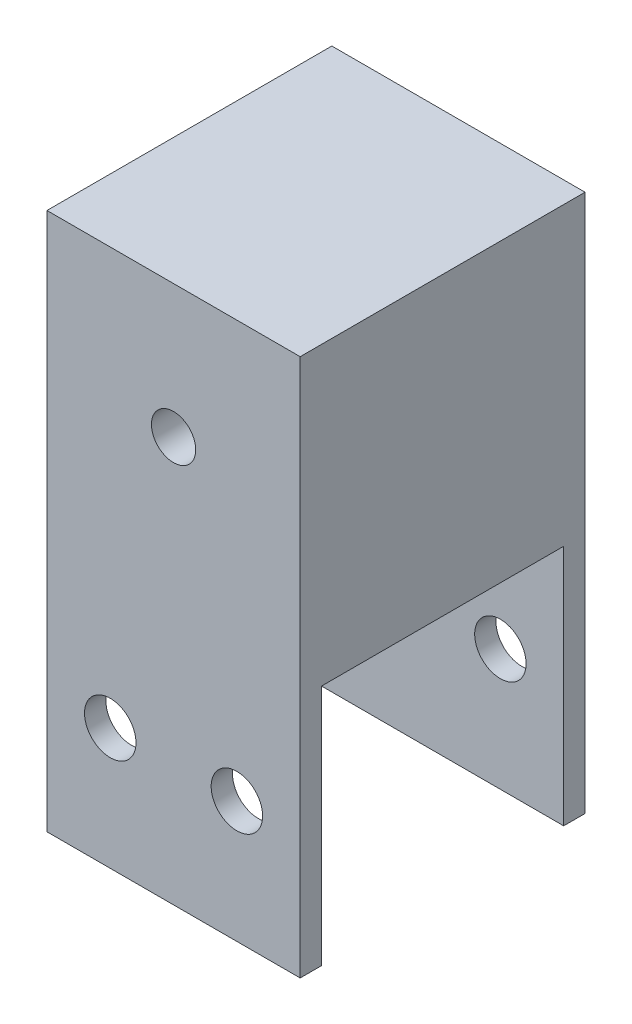
from build123d import *

# Parameters (mm, degrees)
ESQUISSE1_W                  = 40
ESQUISSE1_H                  = 85
BOSS_EXTRU_1_DEPTH           = 45
ESQUISSE2_W                  = 38.25
ESQUISSE2_H                  = 38.25
ENL_V_MAT_EXTRU_1_DEPTH      = 105.16333328
ENL_V_MAT_EXTRU_2_DEPTH      = 103.75038017
ENL_V_MAT_EXTRU_2_DEPTH_BACK = 103.75038017
ESQUISSE3_R                  = 4.065
ESQUISSE6_R                  = 6.675
BOSS_EXTRU_2_DEPTH           = 5
ENL_V_MAT_EXTRU_4_DEPTH      = 105.16333328
ENL_V_MAT_EXTRU_4_DEPTH_BACK = 105.16333328
ESQUISSE4_R                  = 3.5


with BuildPart() as part:
    # Esquisse1 → Boss.-Extru.1 (new body)
    with BuildSketch(Plane.XY):
        with Locations((20, 42.5)):
            Rectangle(ESQUISSE1_W, ESQUISSE1_H)
    extrude(amount=BOSS_EXTRU_1_DEPTH)

    # Esquisse2 → Enlèv. mat.-Extru.1 (cut, through all)
    with BuildSketch(Plane(origin=(40, 0, 0), x_dir=(0, 0, -1), z_dir=(1, 0, 0))):
        with Locations((-22.5, 19.125)):
            Rectangle(ESQUISSE2_W, ESQUISSE2_H)
    extrude(amount=-ENL_V_MAT_EXTRU_1_DEPTH, mode=Mode.SUBTRACT)

    # Esquisse3 → Enlèv. mat.-Extru.2 (cut, two sides: drawn at the far end of the back side and taken through both)
    with BuildSketch(Plane(origin=(0, 0, 41.625), x_dir=(-1, 0, 0), z_dir=(0, 0, -1)).offset(-ENL_V_MAT_EXTRU_2_DEPTH_BACK)):
        with Locations((-30, 19.2)):
            Circle(ESQUISSE3_R)
        with Locations((-10, 19.2)):
            Circle(ESQUISSE3_R)
    extrude(amount=ENL_V_MAT_EXTRU_2_DEPTH + ENL_V_MAT_EXTRU_2_DEPTH_BACK, mode=Mode.SUBTRACT)

    # Esquisse6 → Boss.-Extru.2 (add)
    with BuildSketch(Plane.XY):
        with Locations((20, 64)):
            Circle(ESQUISSE6_R)
    extrude(amount=-BOSS_EXTRU_2_DEPTH)

    # Esquisse4 → Enlèv. mat.-Extru.4 (cut, two sides: drawn at the far end of the back side and taken through both)
    with BuildSketch(Plane(origin=(0, 0, 0), x_dir=(-1, 0, 0), z_dir=(0, 0, -1)).offset(-ENL_V_MAT_EXTRU_4_DEPTH_BACK)):
        with Locations((-20, 64)):
            Circle(ESQUISSE4_R)
    extrude(amount=ENL_V_MAT_EXTRU_4_DEPTH + ENL_V_MAT_EXTRU_4_DEPTH_BACK, mode=Mode.SUBTRACT)


solid = part.part
